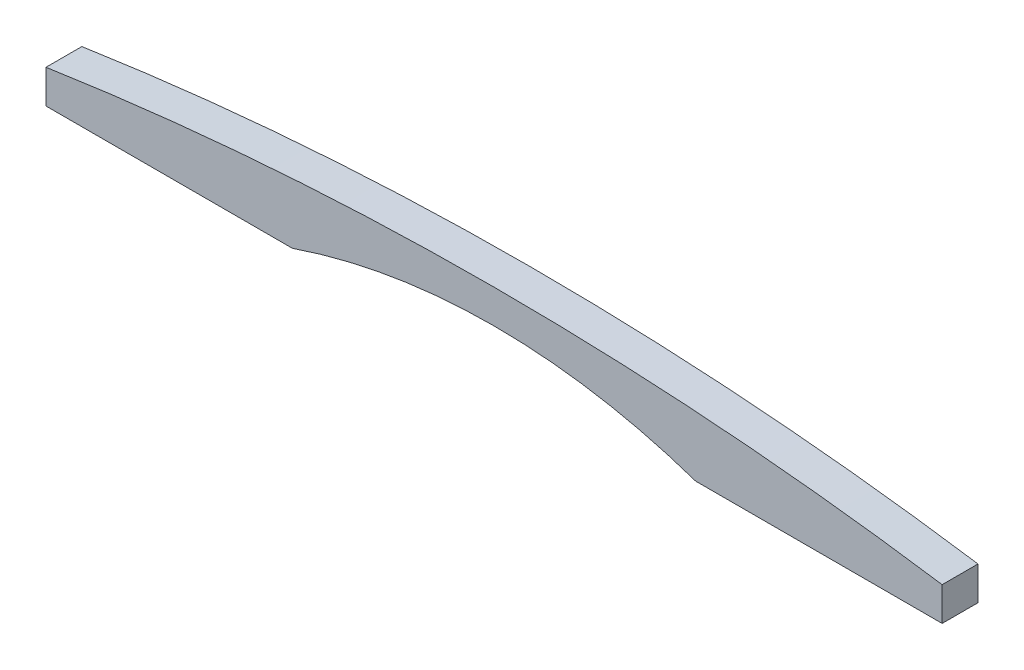
from build123d import *

# Parameters (mm, degrees)
BOSS_EXTRU_1_DEPTH = 8


with BuildPart() as part:
    # Esquisse1 → Boss.-Extru.1 (new body)
    with BuildSketch(Plane.XY):
        with BuildLine():
            Line((-100, 0), (-100, 7.5))
            ThreePointArc((-100, 7.5), (0, 15), (100, 7.5))
            Line((100, 7.5), (100, 0))
            Line((100, 0), (45, 0))
            ThreePointArc((45, 0), (0, 7.5), (-45, 0))
            Line((-45, 0), (-100, 0))
        make_face()
    extrude(amount=BOSS_EXTRU_1_DEPTH)


solid = part.part
